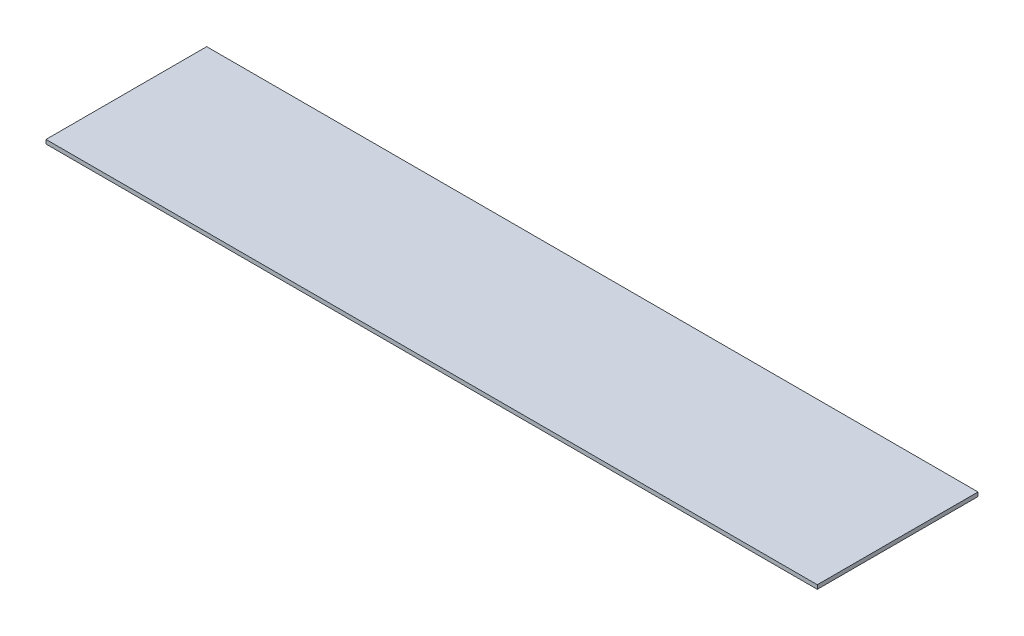
from build123d import *

# Parameters (mm, degrees)
SKETCH1_W      = 1219.2
SKETCH1_H      = 254
EXTRUDE1_DEPTH = 6.35


with BuildPart() as part:
    # Sketch1 → Extrude1 (new body)
    with BuildSketch(Plane(origin=(0, 0, 0), x_dir=(1, 0, 0), z_dir=(0, 1, 0))):
        with Locations((609.6, 127)):
            Rectangle(SKETCH1_W, SKETCH1_H)
    extrude(amount=EXTRUDE1_DEPTH)


solid = part.part
